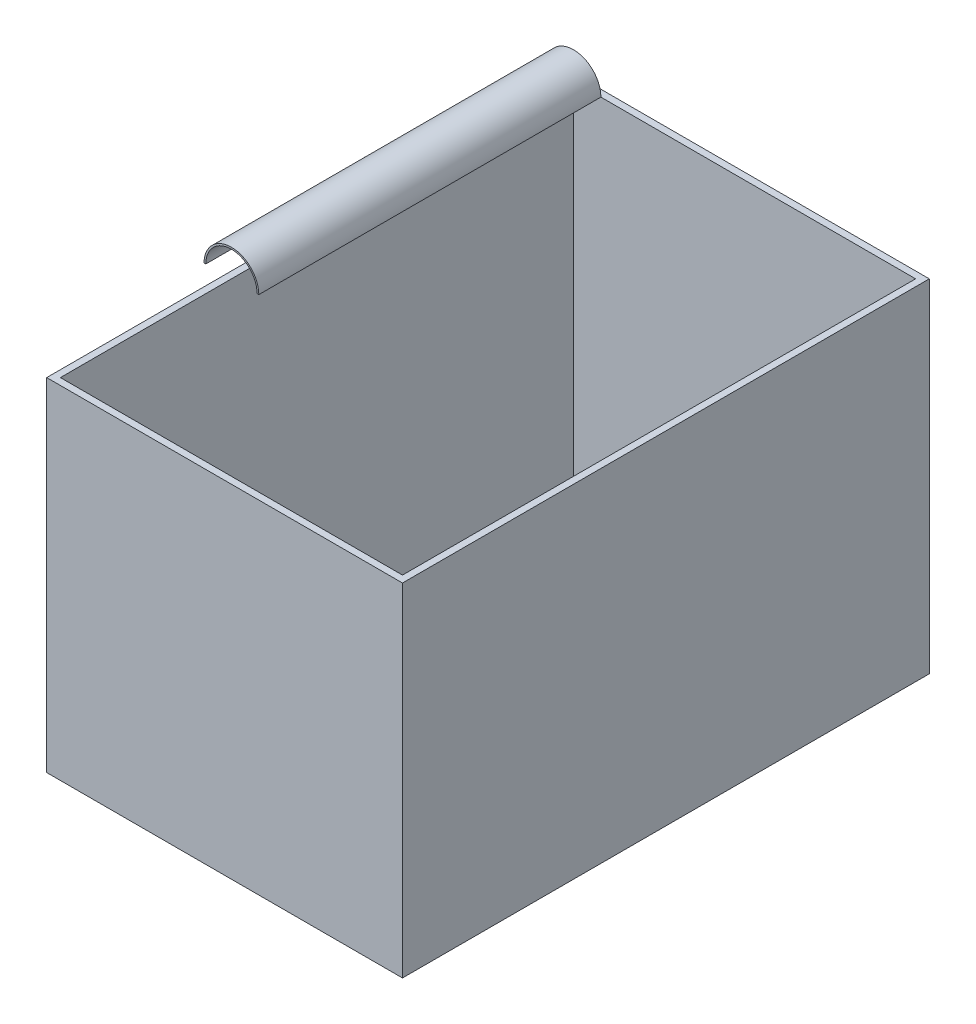
from build123d import *

# Parameters (mm, degrees)
SKETCH1_W           = 208
SKETCH1_H           = 308
SKETCH1_W_2         = 200
SKETCH1_H_2         = 300
BOSS_EXTRUDE1_DEPTH = 200
BOSS_EXTRUDE2_START = -304
BOSS_EXTRUDE2_DEPTH = 200


with BuildPart() as part:
    # Sketch1 → Boss-Extrude1 (new body)
    with BuildSketch(Plane(origin=(0, 0, 0), x_dir=(1, 0, 0), z_dir=(0, 1, 0))):
        with Locations((100, 150)):
            Rectangle(SKETCH1_W, SKETCH1_H)
        with Locations((100, 150)):
            Rectangle(SKETCH1_W_2, SKETCH1_H_2, mode=Mode.SUBTRACT)
    extrude(amount=BOSS_EXTRUDE1_DEPTH)


with BuildPart() as body_2:
    # Sketch4 → Boss-Extrude2 (new body)
    with BuildSketch(Plane(origin=(0, 0, -304), x_dir=(-1, 0, 0), z_dir=(0, 0, -1)).offset(BOSS_EXTRUDE2_START)):
        with BuildLine():
            Line((-116, 300), (-115, 300))
            ThreePointArc((-115, 300), (-100, 315), (-85, 300))
            Line((-85, 300), (-84, 300))
            ThreePointArc((-84, 300), (-100, 316), (-116, 300))
        make_face()
    extrude(amount=BOSS_EXTRUDE2_DEPTH)


solid = Compound([part.part, body_2.part])
